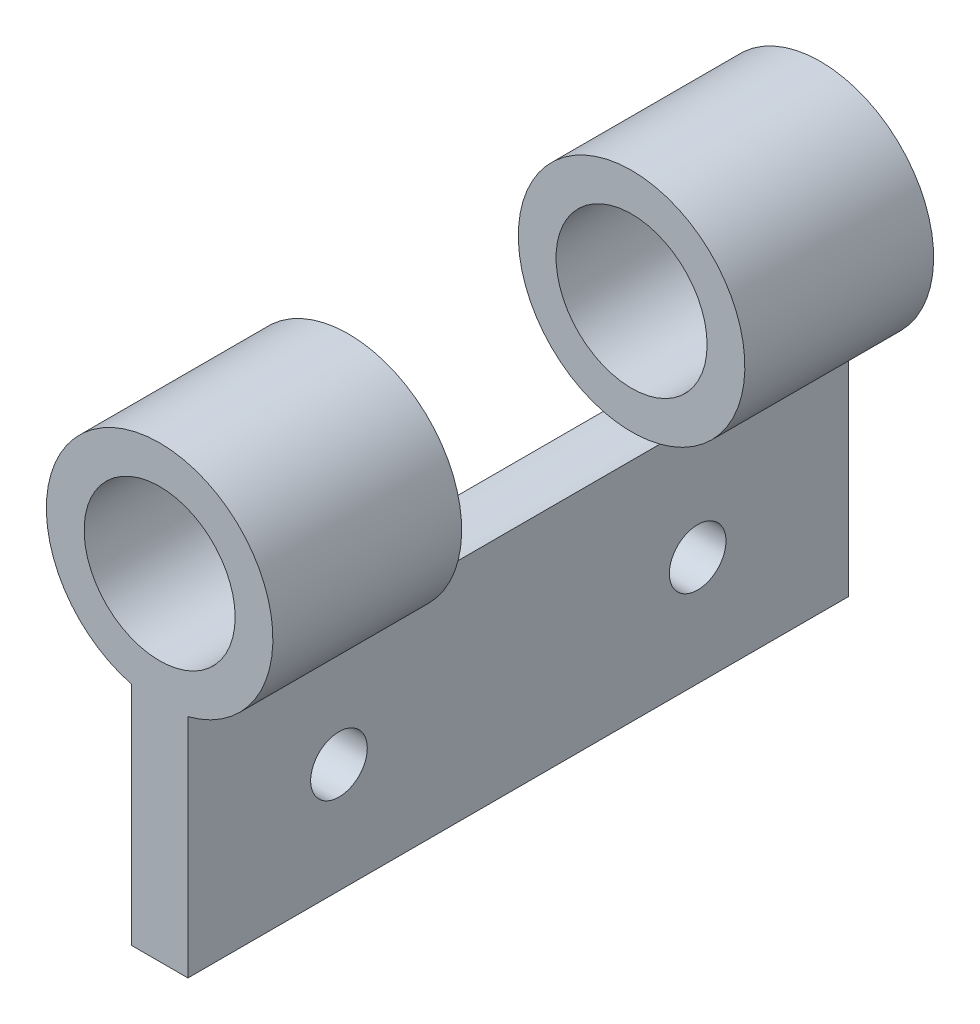
from build123d import *

# Parameters (mm, degrees)
SKETCH2_R           = 2
BOSS_EXTRUDE4_DEPTH = 17.5
CUT_EXTRUDE3_START  = -5
SKETCH2_4_R         = 3
SKETCH2_4_R_2       = 2
CUT_EXTRUDE3_DEPTH  = 7.5
SKETCH4_R           = 0.75
CUT_EXTRUDE6_DEPTH  = 10


with BuildPart() as part:
    # Sketch2 → Boss-Extrude4 (new body)
    with BuildSketch(Plane.XY):
        with BuildLine():
            Line((-0.75, -2.90473751), (-0.75, -8.9))
            Line((-0.75, -8.9), (0.75, -8.9))
            Line((0.75, -8.9), (0.75, -2.90473751))
            ThreePointArc((0.75, -2.90473751), (0, 3), (-0.75, -2.90473751))
        make_face()
        Circle(SKETCH2_R, mode=Mode.SUBTRACT)
    extrude(amount=-BOSS_EXTRUDE4_DEPTH)

    # Sketch2<4> → Cut-Extrude3 (cut)
    with BuildSketch(Plane.XY.offset(CUT_EXTRUDE3_START)):
        Circle(SKETCH2_4_R)
        Circle(SKETCH2_4_R_2, mode=Mode.SUBTRACT)
    extrude(amount=-CUT_EXTRUDE3_DEPTH, mode=Mode.SUBTRACT)

    # Sketch4 → Cut-Extrude6 (cut)
    with BuildSketch(Plane(origin=(0.75, 0, 0), x_dir=(0, 0, -1), z_dir=(1, 0, 0))):
        with Locations((4, -6)):
            Circle(SKETCH4_R)
        with Locations((13.5, -6)):
            Circle(SKETCH4_R)
    extrude(amount=-CUT_EXTRUDE6_DEPTH, mode=Mode.SUBTRACT)


solid = part.part
